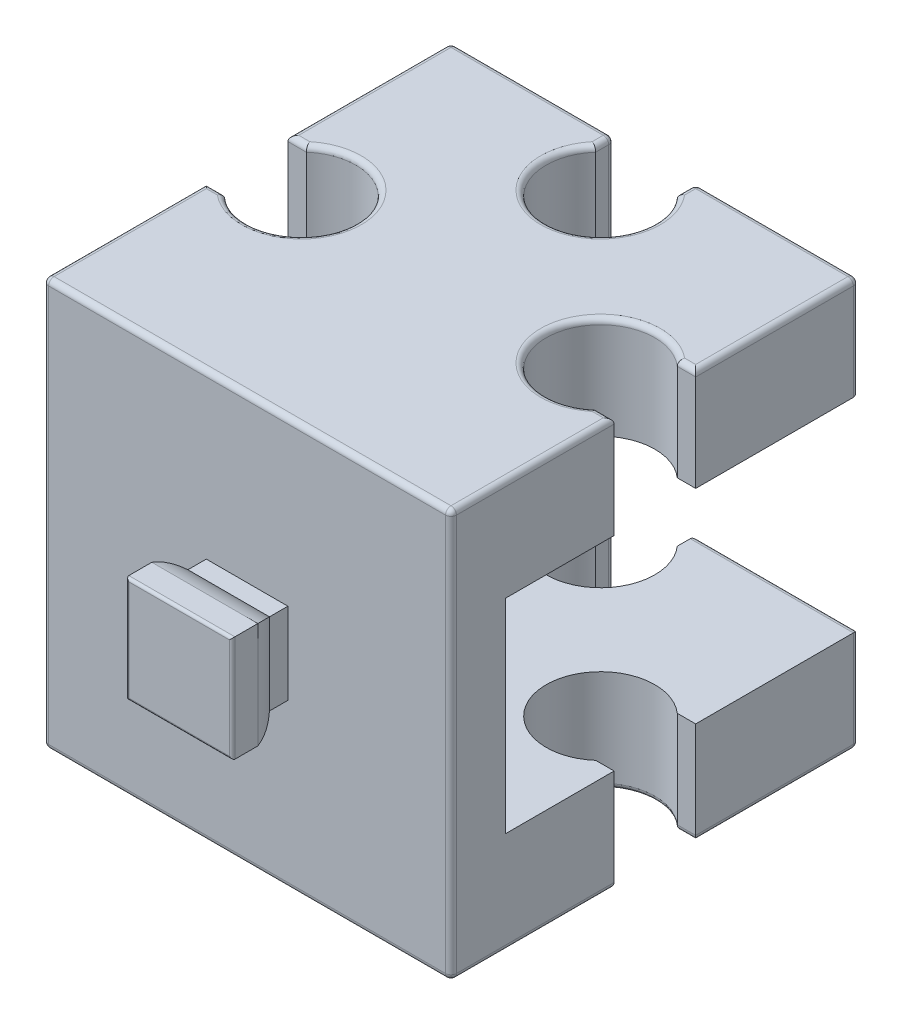
from build123d import *

# Parameters (mm, degrees)
SKETCH_1_W                      = 15
SKETCH_1_H                      = 15
EXTRUDE_1_DEPTH                 = 15
EXTRUDE_2_DEPTH                 = 1.5
EXTRUDE_2_DEPTH_BACK            = 1.5
SKETCH_2_W                      = 3
SKETCH_2_H                      = 1
EXTRUDE_3_DEPTH                 = 3
EXTRUDE_3_DEPTH_BACK            = 3
CUT_EXTRUDE_7_REACH             = 20.371
CUT_EXTRUDE_7_DIRECTION_2_REACH = 20.371
FILLET_2_R                      = 0.1
CUT_EXTRUDE_8_DEPTH             = 23.5
SKETCH_14_W                     = 13
SKETCH_14_H                     = 7.5
CUT_EXTRUDE_9_DEPTH             = 23.5
FILLET_3_R                      = 0.2


with BuildPart() as part:
    # 草图1 → 凸台-拉伸1 (new body)
    with BuildSketch(Plane.XY):
        Rectangle(SKETCH_1_W, SKETCH_1_H)
    extrude(amount=-EXTRUDE_1_DEPTH)

    # 草图2 → 凸台-拉伸2 (add, two sides: drawn at the far end of the back side and taken through both)
    with BuildSketch(Plane(origin=(0, 0, 0), x_dir=(1, 0, 0), z_dir=(0, 1, 0)).offset(-EXTRUDE_2_DEPTH_BACK)):
        with Locations((0, -0.5)):
            Rectangle(SKETCH_2_W, SKETCH_2_H)
    extrude(amount=EXTRUDE_2_DEPTH + EXTRUDE_2_DEPTH_BACK)

    # 草图3 → 凸台-拉伸3 (add, two sides: drawn at the far end of the back side and taken through both)
    with BuildSketch(Plane(origin=(0, 0, 0), x_dir=(1, 0, 0), z_dir=(0, 1, 0)).offset(-EXTRUDE_3_DEPTH_BACK)):
        with BuildLine():
            Line((-1.95, -2.5), (1.95, -2.5))
            Line((1.95, -2.5), (1.95, -1.555590279))
            ThreePointArc((1.95, -1.555590279), (1.780042303, -1.088161527), (1.5, -0.677124344))
            Line((1.5, -0.677124344), (-1.5, -0.677124344))
            ThreePointArc((-1.5, -0.677124344), (-1.780042303, -1.088161527), (-1.95, -1.555590279))
            Line((-1.95, -1.555590279), (-1.95, -2.5))
        make_face()
    extrude(amount=EXTRUDE_3_DEPTH + EXTRUDE_3_DEPTH_BACK)

    # 草图12 → 切除-拉伸7 (cut, up to next)
    with BuildSketch(Plane(origin=(0, 0, 0), x_dir=(0, 0, -1), z_dir=(1, 0, 0)), mode=Mode.PRIVATE) as cut_extrude_7_sk1:
        with BuildLine():
            Line((-2.5, 3), (-2.5, 1.95))
            Line((-2.5, 1.95), (-1.555590279, 1.95))
            ThreePointArc((-1.555590279, 1.95), (-1.088161527, 1.780042303), (-0.677124344, 1.5))
            Line((-0.677124344, 1.5), (-0.677124344, 3))
            Line((-0.677124344, 3), (-2.5, 3))
        make_face()
    cut_extrude_7_tool1 = extrude(cut_extrude_7_sk1.sketch, amount=-CUT_EXTRUDE_7_REACH, mode=Mode.PRIVATE) & part.part
    # 草图12 → 切除-拉伸7 (cut, up to next)
    with BuildSketch(Plane(origin=(0, 0, 0), x_dir=(0, 0, -1), z_dir=(1, 0, 0)), mode=Mode.PRIVATE) as cut_extrude_7_sk2:
        with BuildLine():
            Line((-2.5, -1.95), (-1.555590279, -1.95))
            ThreePointArc((-1.555590279, -1.95), (-1.088161527, -1.780042303), (-0.677124344, -1.5))
            Line((-0.677124344, -1.5), (-0.677124344, -3))
            Line((-0.677124344, -3), (-2.5, -3))
            Line((-2.5, -3), (-2.5, -1.95))
        make_face()
    cut_extrude_7_tool2 = extrude(cut_extrude_7_sk2.sketch, amount=-CUT_EXTRUDE_7_REACH, mode=Mode.PRIVATE) & part.part
    add(cut_extrude_7_tool1.solids().sort_by_distance((0, 2.424924, 1.539049))[0], mode=Mode.SUBTRACT)
    add(cut_extrude_7_tool2.solids().sort_by_distance((0, -2.424924, 1.539049))[0], mode=Mode.SUBTRACT)

    # 草图12 → 切除-拉伸7 direction 2 (cut, up to next)
    with BuildSketch(Plane(origin=(0, 0, 0), x_dir=(0, 0, -1), z_dir=(1, 0, 0)), mode=Mode.PRIVATE) as cut_extrude_7_direction_2_sk1:
        with BuildLine():
            Line((-2.5, 3), (-2.5, 1.95))
            Line((-2.5, 1.95), (-1.555590279, 1.95))
            ThreePointArc((-1.555590279, 1.95), (-1.088161527, 1.780042303), (-0.677124344, 1.5))
            Line((-0.677124344, 1.5), (-0.677124344, 3))
            Line((-0.677124344, 3), (-2.5, 3))
        make_face()
    cut_extrude_7_direction_2_tool1 = extrude(cut_extrude_7_direction_2_sk1.sketch, amount=CUT_EXTRUDE_7_DIRECTION_2_REACH, mode=Mode.PRIVATE) & part.part
    # 草图12 → 切除-拉伸7 direction 2 (cut, up to next)
    with BuildSketch(Plane(origin=(0, 0, 0), x_dir=(0, 0, -1), z_dir=(1, 0, 0)), mode=Mode.PRIVATE) as cut_extrude_7_direction_2_sk2:
        with BuildLine():
            Line((-2.5, -1.95), (-1.555590279, -1.95))
            ThreePointArc((-1.555590279, -1.95), (-1.088161527, -1.780042303), (-0.677124344, -1.5))
            Line((-0.677124344, -1.5), (-0.677124344, -3))
            Line((-0.677124344, -3), (-2.5, -3))
            Line((-2.5, -3), (-2.5, -1.95))
        make_face()
    cut_extrude_7_direction_2_tool2 = extrude(cut_extrude_7_direction_2_sk2.sketch, amount=CUT_EXTRUDE_7_DIRECTION_2_REACH, mode=Mode.PRIVATE) & part.part
    add(cut_extrude_7_direction_2_tool1.solids().sort_by_distance((0, 2.424924, 1.539049))[0], mode=Mode.SUBTRACT)
    add(cut_extrude_7_direction_2_tool2.solids().sort_by_distance((0, -2.424924, 1.539049))[0], mode=Mode.SUBTRACT)

    # 圆角2
    fillet_2_edges = [part.edges().sort_by_distance(p)[0] for p in [
        (0, 1.95, 2.5),
        (-1.95, 0, 2.5),
        (1.95, 0, 2.5),
        (0, -1.95, 2.5),
    ]]
    fillet(fillet_2_edges, radius=FILLET_2_R)

    # 草图13 → 切除-拉伸8 (cut, through all)
    with BuildSketch(Plane(origin=(0, -7.5, 0), x_dir=(-1, 0, 0), z_dir=(0, -1, 0))):
        with BuildLine():
            Line((1.5, 15), (-1.5, 15))
            Line((-1.5, 15), (-1.5, 14.322875656))
            ThreePointArc((-1.5, 14.322875656), (0, 11), (1.5, 14.322875656))
            Line((1.5, 14.322875656), (1.5, 15))
        make_face()
        with BuildLine():
            Line((7.5, 6), (7.5, 9))
            Line((7.5, 9), (6.822875656, 9))
            ThreePointArc((6.822875656, 9), (3.5, 7.5), (6.822875656, 6))
            Line((6.822875656, 6), (7.5, 6))
        make_face()
        with BuildLine():
            Line((-7.5, 9), (-7.5, 6))
            Line((-7.5, 6), (-6.822875656, 6))
            ThreePointArc((-6.822875656, 6), (-3.5, 7.5), (-6.822875656, 9))
            Line((-6.822875656, 9), (-7.5, 9))
        make_face()
    extrude(amount=-CUT_EXTRUDE_8_DEPTH, mode=Mode.SUBTRACT)

    # 草图14 → 切除-拉伸9 (cut, through all)
    with BuildSketch(Plane.ZY.offset(7.5)):
        with Locations((-8.5, 0)):
            Rectangle(SKETCH_14_W, SKETCH_14_H)
    extrude(amount=-CUT_EXTRUDE_9_DEPTH, mode=Mode.SUBTRACT)

    # 圆角3
    fillet_3_edges = [part.edges().sort_by_distance(p)[0] for p in [
        (7.5, -5.625, -15),
        (-7.5, -7.5, -3),
        (-7.5, 7.5, -3),
        (-3.5, 7.5, -7.5),
        (-7.161437828, 7.5, -9),
        (-7.161437828, 7.5, -6),
        (-3.5, -7.5, -7.5),
        (-7.161437828, -7.5, -6),
        (-7.161437828, -7.5, -9),
        (7.5, -7.5, -3),
        (7.5, 7.5, -3),
        (3.5, 7.5, -7.5),
        (7.161437828, 7.5, -6),
        (7.161437828, 7.5, -9),
        (3.5, -7.5, -7.5),
        (7.161437828, -7.5, -9),
        (7.161437828, -7.5, -6),
        (4.5, 7.5, -15),
        (-1.5, -5.625, -15),
        (1.5, -5.625, -15),
        (-7.5, -5.625, -15),
        (7.5, 5.625, -15),
        (4.5, -3.75, -15),
        (-4.5, -3.75, -15),
        (4.5, 3.75, -15),
        (-4.5, 3.75, -15),
        (-7.5, 5.625, -15),
        (0, 7.5, 0),
        (7.5, 0, 0),
        (0, -7.5, 0),
        (-7.5, 0, 0),
        (-4.5, -7.5, -15),
        (-7.5, 7.5, -12),
        (7.5, 7.5, -12),
        (7.5, -7.5, -12),
        (-7.5, -7.5, -12),
        (-4.5, 7.5, -15),
        (4.5, -7.5, -15),
        (0, 7.5, -11),
        (1.5, 7.5, -14.661437828),
        (1.5, 5.625, -15),
        (-1.5, 7.5, -14.661437828),
        (-1.5, 5.625, -15),
        (0, -7.5, -11),
        (-1.5, -7.5, -14.661437828),
        (1.5, -7.5, -14.661437828),
    ]]
    fillet(fillet_3_edges, radius=FILLET_3_R)


solid = part.part
